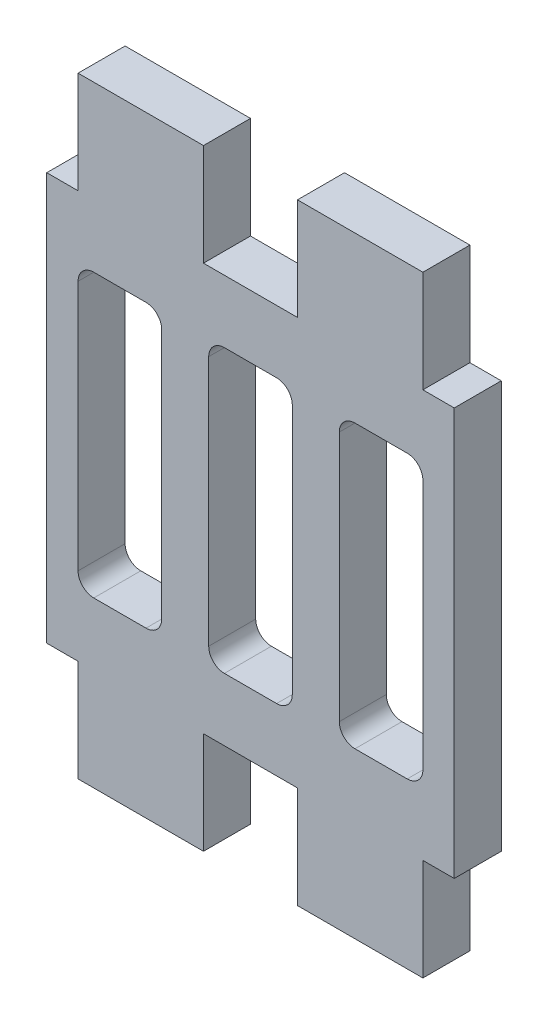
from build123d import *

# Parameters (mm, degrees)
SKETCH_1_W      = 5.333333333
SKETCH_1_H      = 18
SKETCH_1_W_2    = 5.333333334
EXTRUDE_1_DEPTH = 3
FILLET_2_R      = 1


with BuildPart() as part:
    # 草图1 → 凸台-拉伸1 (new body)
    with BuildSketch(Plane.XY):
        Polygon((-11, 19.5), (-11, 13), (-13, 13), (-13, -13), (-11, -13), (-11, -19.5), (-3, -19.5), (-3, -13), (3, -13), (3, -19.5), (11, -19.5), (11, -13), (13, -13), (13, 13), (11, 13), (11, 19.5), (3, 19.5), (3, 13), (-3, 13), (-3, 19.5), align=None)
        with Locations((8.333333334, 0)):
            Rectangle(SKETCH_1_W, SKETCH_1_H, mode=Mode.SUBTRACT)
        with Locations((-8.333333334, 0)):
            Rectangle(SKETCH_1_W, SKETCH_1_H, mode=Mode.SUBTRACT)
        Rectangle(SKETCH_1_W_2, SKETCH_1_H, mode=Mode.SUBTRACT)
    extrude(amount=EXTRUDE_1_DEPTH)

    # 圆角2
    fillet_2_edges = [part.edges().sort_by_distance(p)[0] for p in [
        (5.666666667, 9, 1.5),
        (5.666666667, -9, 1.5),
        (11, -9, 1.5),
        (11, 9, 1.5),
        (-11, 9, 1.5),
        (-11, -9, 1.5),
        (-5.666666667, -9, 1.5),
        (-5.666666667, 9, 1.5),
        (-2.666666667, 9, 1.5),
        (-2.666666667, -9, 1.5),
        (2.666666667, -9, 1.5),
        (2.666666667, 9, 1.5),
    ]]
    fillet(fillet_2_edges, radius=FILLET_2_R)


solid = part.part
